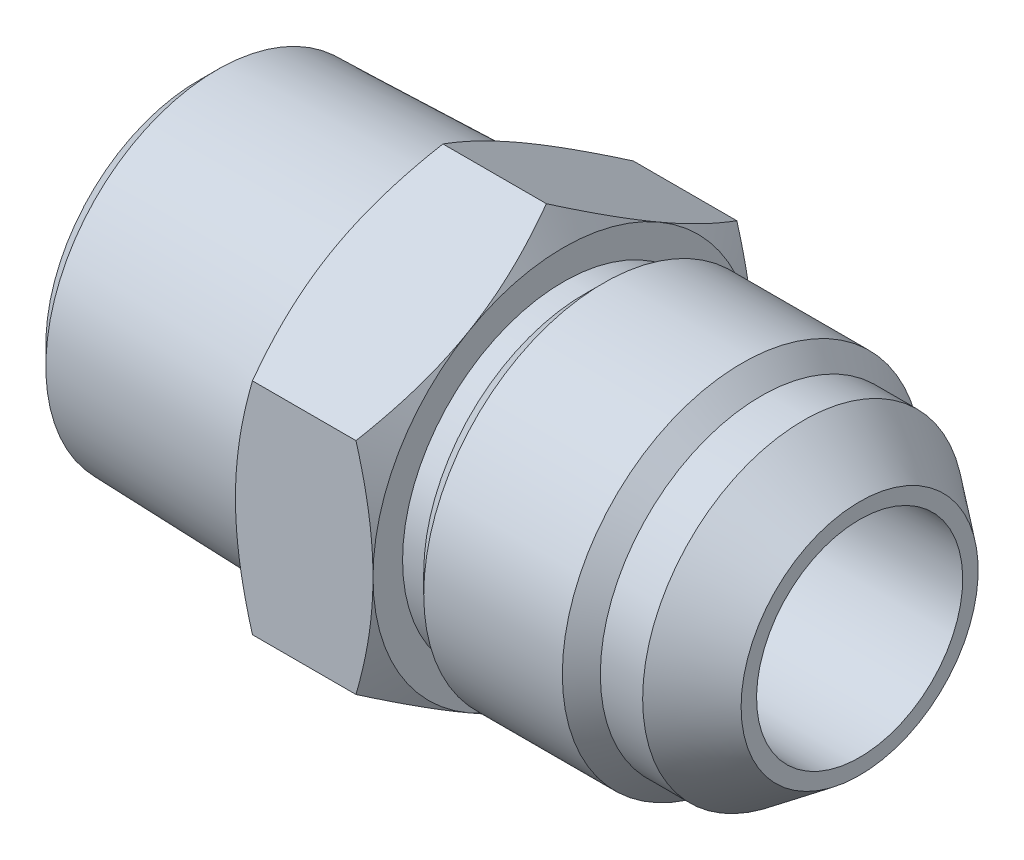
from build123d import *

# Parameters (mm, degrees)
SKETCH6_W           = 49.6062
SKETCH6_H           = 13.49375
EXTRUDE1_DEPTH      = 10.31875
SKETCH7_W           = 49.6062
SKETCH7_H           = 7.7343
SKETCH17_R          = 13.49375
CUT_EXTRUDE1_DEPTH  = 17.06245
SKETCH19_R          = 13.335
BOSS_EXTRUDE1_DEPTH = 17.06245
BOSS_EXTRUDE1_DRAFT = -1.75
CHAMFER1_SIZE       = 1.360714286
CHAMFER1_SIZE2      = 1.404253042
SKETCH22_R          = 13.335
BOSS_EXTRUDE3_DEPTH = 17.06245
BOSS_EXTRUDE3_DRAFT = -15
SKETCH23_R          = 10.690980718
CUT_EXTRUDE2_DEPTH  = 17.06245


with BuildPart() as part:
    # Sketch6 → Revolve3 (revolve)
    with BuildSketch(Plane.XY, mode=Mode.PRIVATE) as revolve3_sk:
        with Locations((0, 6.746875)):
            Rectangle(SKETCH6_W, SKETCH6_H)
    revolve(revolve3_sk.sketch.rotate(Axis((-24.8031, 0, 0), (1, 0, 0)), 90), axis=Axis((-24.8031, 0, 0), (1, 0, 0)))

    # Sketch12 → Extrude1 (add)
    with BuildSketch(Plane(origin=(-7.74065, 0, 0), x_dir=(0, 0, -1), z_dir=(1, 0, 0))):
        Polygon((0, 16.497783942), (-14.2875, 8.248891971), (-14.2875, -8.248891971), (0, -16.497783942), (14.2875, -8.248891971), (14.2875, 8.248891971), align=None)
    extrude(amount=EXTRUDE1_DEPTH)

    # Sketch10 → Cut-Revolve6 (revolve, cut)
    with BuildSketch(Plane.XY, mode=Mode.PRIVATE) as cut_revolve6_sk:
        Polygon((5.591215329, 13.49375), (2.5781, 13.49375), (2.5781, 12.068134671), (4.1656, 12.068134671), align=None)
        Polygon((24.8031, 13.49375), (15.990856228, 13.49375), (17.416471556, 12.068134671), (20.591471556, 12.068134671), (24.8031, 8.894445), align=None)
    revolve(cut_revolve6_sk.sketch.rotate(Axis((-24.8031, 0, 0), (1, 0, 0)), 90), axis=Axis((-24.8031, 0, 0), (1, 0, 0)), mode=Mode.SUBTRACT)

    # Sketch7 → Cut-Revolve5 (revolve, cut)
    with BuildSketch(Plane.XY):
        with Locations((0, 3.86715)):
            Rectangle(SKETCH7_W, SKETCH7_H)
    revolve(axis=Axis((24.8031, 0, 0), (-1, 0, 0)), mode=Mode.SUBTRACT)

    # Sketch13 → Cut-Revolve7 (revolve, cut)
    with BuildSketch(Plane.XY):
        Polygon((-7.74065, 16.497783942), (-7.74065, 14.2875), (-6.464541971, 16.497783942), align=None)
        Polygon((1.301991971, 16.497783942), (2.5781, 14.2875), (2.5781, 16.497783942), align=None)
    revolve(axis=Axis((-24.8031, 0, 0), (1, 0, 0)), mode=Mode.SUBTRACT)

    # Sketch17 → Cut-Extrude1 (cut)
    with BuildSketch(Plane.ZY.offset(24.8031)):
        Circle(SKETCH17_R)
    extrude(amount=-CUT_EXTRUDE1_DEPTH, mode=Mode.SUBTRACT)


with BuildPart() as body_2:
    # Sketch19 → Boss-Extrude1 (with draft: the straight prism first)
    with BuildSketch(Plane(origin=(-7.74065, 0, 0), x_dir=(0, 0, -1), z_dir=(1, 0, 0))):
        Circle(SKETCH19_R)
    extrude(amount=-BOSS_EXTRUDE1_DEPTH)
    # Boss-Extrude1: the draft: its side faces are tilted about the plane it starts from
    boss_extrude1_sides = [body_2.faces().sort_by_distance(p)[0] for p in [
        (-16.271875, 0, 13.335),
    ]]
    draft(boss_extrude1_sides, Plane(origin=(-7.74065, 0, 0), x_dir=(0, 0, -1), z_dir=(1, 0, 0)), BOSS_EXTRUDE1_DRAFT)

    # Chamfer1
    chamfer1_edges = [body_2.edges().sort_by_distance(p)[0] for p in [
        (-24.8031, 0, 12.813695004),
    ]]
    chamfer1_side = [body_2.faces().sort_by_distance(p)[0] for p in [
        (-24.8031, 0, 0),
    ]]
    chamfer(chamfer1_edges, length=CHAMFER1_SIZE, length2=CHAMFER1_SIZE2, reference=chamfer1_side[0])


with BuildPart() as boss_extrude3_tool:
    # Sketch22 → Boss-Extrude3 (with draft: the straight prism first)
    with BuildSketch(Plane(origin=(-7.74065, 0, 0), x_dir=(0, 0, -1), z_dir=(1, 0, 0))):
        Circle(SKETCH22_R)
    extrude(amount=-BOSS_EXTRUDE3_DEPTH)
    # Boss-Extrude3: the draft: its side faces are tilted about the plane it starts from
    boss_extrude3_sides = [boss_extrude3_tool.faces().sort_by_distance(p)[0] for p in [
        (-16.271875, 0, 13.335),
    ]]
    draft(boss_extrude3_sides, Plane(origin=(-7.74065, 0, 0), x_dir=(0, 0, -1), z_dir=(1, 0, 0)), BOSS_EXTRUDE3_DRAFT)


with BuildPart() as body_2_1:
    add(body_2.part)

    # Boss-Extrude3: add boss_extrude3_tool
    add(boss_extrude3_tool.part)

    # Combine1: union part
    add(part.part)

    # Sketch23 → Cut-Extrude2 (cut)
    with BuildSketch(Plane.ZY.offset(24.8031)):
        Circle(SKETCH23_R)
    extrude(amount=-CUT_EXTRUDE2_DEPTH, mode=Mode.SUBTRACT)


solid = body_2_1.part
